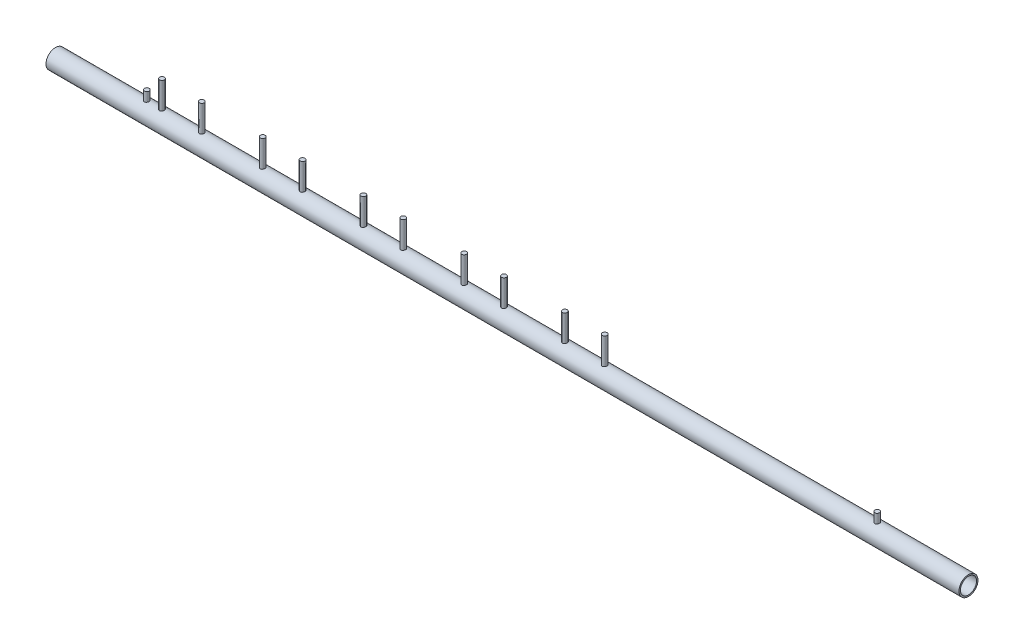
from build123d import *

# Parameters (mm, degrees)
SKETCH2_R           = 15.875
SKETCH2_R_2         = 13.462
BOSS_EXTRUDE2_DEPTH = 1524
BOSS_EXTRUDE3_START = 12
SKETCH3_R           = 4
BOSS_EXTRUDE3_DEPTH = 19.05
SKETCH4_R           = 4
BOSS_EXTRUDE4_DEPTH = 60


with BuildPart() as part:
    # Sketch2 → Boss-Extrude2 (new body)
    with BuildSketch(Plane(origin=(0, 0, 0), x_dir=(0, 0, -1), z_dir=(1, 0, 0))):
        Circle(SKETCH2_R)
        Circle(SKETCH2_R_2, mode=Mode.SUBTRACT)
    extrude(amount=BOSS_EXTRUDE2_DEPTH)

    # Sketch3 → Boss-Extrude3 (add)
    with BuildSketch(Plane(origin=(0, 0, 0), x_dir=(1, 0, 0), z_dir=(0, 1, 0)).offset(BOSS_EXTRUDE3_START)):
        with Locations(Location((152.4, 0, 0), (0, 0, 90))):
            Circle(SKETCH3_R)
        with Locations(Location((1371.6, 0, 0), (0, 0, 90))):
            Circle(SKETCH3_R)
    extrude(amount=BOSS_EXTRUDE3_DEPTH)

    # Sketch4 → Boss-Extrude4 (add)
    with BuildSketch(Plane(origin=(0, 0, 0), x_dir=(1, 0, 0), z_dir=(0, 1, 0))):
        with Locations(Location((244.32, 0, 0), (0, 0, 90))):
            Circle(SKETCH4_R)
        with Locations(Location((177.8, 0, 0), (0, 0, 90))):
            Circle(SKETCH4_R)
        with Locations(Location((345.92, 0, 0), (0, 0, 90))):
            Circle(SKETCH4_R)
        with Locations(Location((412.44, 0, 0), (0, 0, 90))):
            Circle(SKETCH4_R)
        with Locations(Location((514.04, 0, 0), (0, 0, 90))):
            Circle(SKETCH4_R)
        with Locations(Location((580.56, 0, 0), (0, 0, 90))):
            Circle(SKETCH4_R)
        with Locations(Location((682.16, 0, 0), (0, 0, 90))):
            Circle(SKETCH4_R)
        with Locations(Location((748.68, 0, 0), (0, 0, 90))):
            Circle(SKETCH4_R)
        with Locations(Location((850.28, 0, 0), (0, 0, 90))):
            Circle(SKETCH4_R)
        with Locations(Location((916.8, 0, 0), (0, 0, 90))):
            Circle(SKETCH4_R)
    extrude(amount=BOSS_EXTRUDE4_DEPTH)


solid = part.part
